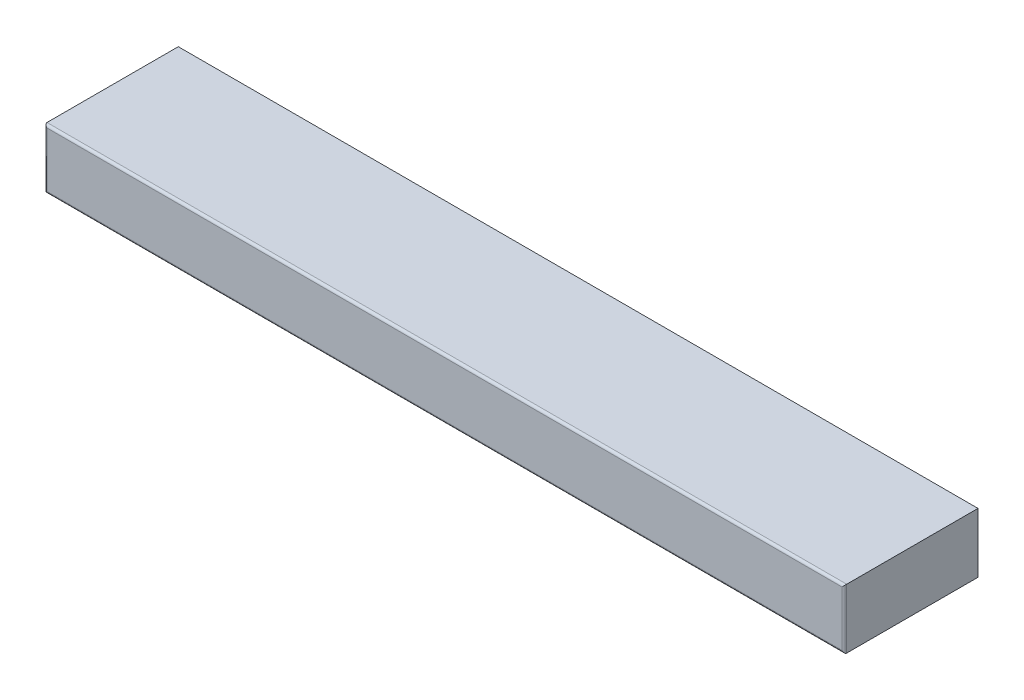
from build123d import *

# Parameters (mm, degrees)
SKETCH1_W           = 67
SKETCH1_H           = 5
BOSS_EXTRUDE1_DEPTH = 11.2
FILLET1_R           = 0.2


with BuildPart() as part:
    # Sketch1 → Boss-Extrude1 (new body)
    with BuildSketch(Plane.XY):
        Rectangle(SKETCH1_W, SKETCH1_H)
    extrude(amount=BOSS_EXTRUDE1_DEPTH)

    # Fillet1
    fillet1_edges = [part.edges().sort_by_distance(p)[0] for p in [
        (-33.5, 0, 11.2),
        (0, -2.5, 11.2),
        (33.5, 0, 11.2),
        (0, 2.5, 11.2),
    ]]
    fillet(fillet1_edges, radius=FILLET1_R)


solid = part.part
